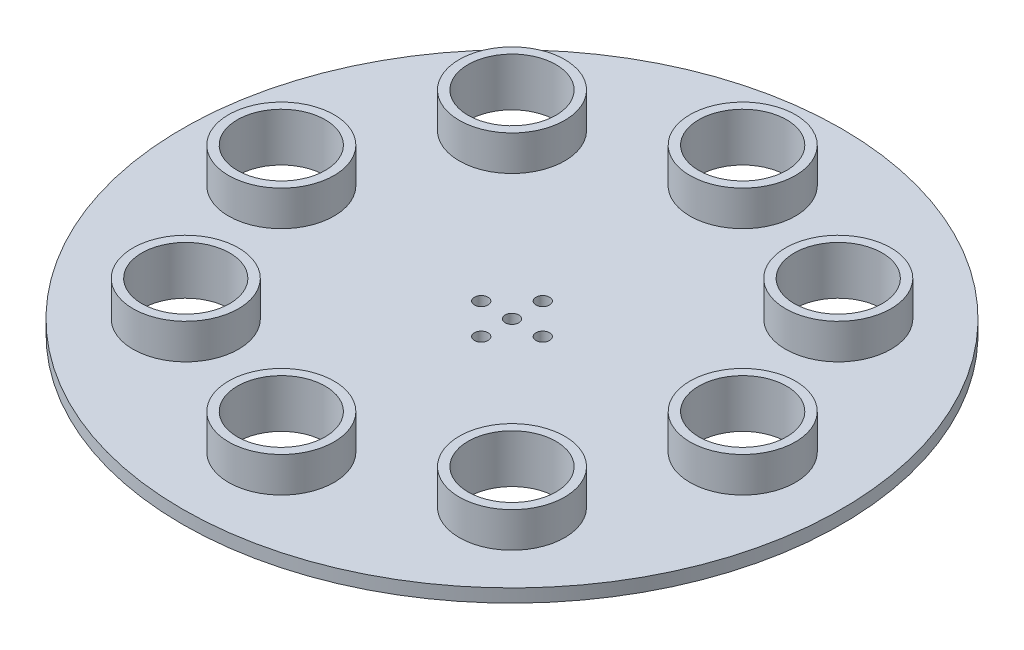
from build123d import *

# Parameters (mm, degrees)
SKETCH_1_R        = 12
SKETCH_1_R_2      = 10
EXTRUDE_2_DEPTH   = 11
EXTRUDE_2_2_DEPTH = 11
EXTRUDE_2_3_DEPTH = 11
EXTRUDE_2_4_DEPTH = 11
EXTRUDE_2_5_DEPTH = 11
EXTRUDE_2_6_DEPTH = 11
EXTRUDE_2_7_DEPTH = 11
EXTRUDE_2_8_DEPTH = 11
SKETCH_1_8_R      = 75
SKETCH_1_8_R_2    = 12
SKETCH_1_8_R_3    = 1.55
EXTRUDE_3_DEPTH   = 3


with BuildPart() as part:
    # 草图1 → 凸台-拉伸2 (new body)
    with BuildSketch(Plane(origin=(0, 0, 0), x_dir=(1, 0, 0), z_dir=(0, 1, 0))):
        with Locations((-37.123106012, 37.123106012)):
            Circle(SKETCH_1_R)
        with Locations((-37.123106012, 37.123106012)):
            Circle(SKETCH_1_R_2, mode=Mode.SUBTRACT)
    extrude(amount=EXTRUDE_2_DEPTH)


with BuildPart() as body_2:
    # 草图1 → Extrude 2 2 (new body)
    with BuildSketch(Plane(origin=(0, 0, 0), x_dir=(1, 0, 0), z_dir=(0, 1, 0))):
        with Locations((0, 52.5)):
            Circle(SKETCH_1_R)
        with Locations((0, 52.5)):
            Circle(SKETCH_1_R_2, mode=Mode.SUBTRACT)
    extrude(amount=EXTRUDE_2_2_DEPTH)


with BuildPart() as body_3:
    # 草图1 → Extrude 2 3 (new body)
    with BuildSketch(Plane(origin=(0, 0, 0), x_dir=(1, 0, 0), z_dir=(0, 1, 0))):
        with Locations((37.123106012, 37.123106012)):
            Circle(SKETCH_1_R)
        with Locations((37.123106012, 37.123106012)):
            Circle(SKETCH_1_R_2, mode=Mode.SUBTRACT)
    extrude(amount=EXTRUDE_2_3_DEPTH)


with BuildPart() as body_4:
    # 草图1 → Extrude 2 4 (new body)
    with BuildSketch(Plane(origin=(0, 0, 0), x_dir=(1, 0, 0), z_dir=(0, 1, 0))):
        with Locations((52.5, 0)):
            Circle(SKETCH_1_R)
        with Locations((52.5, 0)):
            Circle(SKETCH_1_R_2, mode=Mode.SUBTRACT)
    extrude(amount=EXTRUDE_2_4_DEPTH)


with BuildPart() as body_5:
    # 草图1 → Extrude 2 5 (new body)
    with BuildSketch(Plane(origin=(0, 0, 0), x_dir=(1, 0, 0), z_dir=(0, 1, 0))):
        with Locations((37.123106012, -37.123106012)):
            Circle(SKETCH_1_R)
        with Locations((37.123106012, -37.123106012)):
            Circle(SKETCH_1_R_2, mode=Mode.SUBTRACT)
    extrude(amount=EXTRUDE_2_5_DEPTH)


with BuildPart() as body_6:
    # 草图1 → Extrude 2 6 (new body)
    with BuildSketch(Plane(origin=(0, 0, 0), x_dir=(1, 0, 0), z_dir=(0, 1, 0))):
        with Locations((0, -52.5)):
            Circle(SKETCH_1_R)
        with Locations((0, -52.5)):
            Circle(SKETCH_1_R_2, mode=Mode.SUBTRACT)
    extrude(amount=EXTRUDE_2_6_DEPTH)


with BuildPart() as body_7:
    # 草图1 → Extrude 2 7 (new body)
    with BuildSketch(Plane(origin=(0, 0, 0), x_dir=(1, 0, 0), z_dir=(0, 1, 0))):
        with Locations((-37.123106012, -37.123106012)):
            Circle(SKETCH_1_R)
        with Locations((-37.123106012, -37.123106012)):
            Circle(SKETCH_1_R_2, mode=Mode.SUBTRACT)
    extrude(amount=EXTRUDE_2_7_DEPTH)


with BuildPart() as body_8:
    # 草图1 → Extrude 2 8 (new body)
    with BuildSketch(Plane(origin=(0, 0, 0), x_dir=(1, 0, 0), z_dir=(0, 1, 0))):
        with Locations((-52.5, 0)):
            Circle(SKETCH_1_R)
        with Locations((-52.5, 0)):
            Circle(SKETCH_1_R_2, mode=Mode.SUBTRACT)
    extrude(amount=EXTRUDE_2_8_DEPTH)


with BuildPart() as body_9:
    # 草图1<8> → 凸台-拉伸3 (new body)
    with BuildSketch(Plane(origin=(0, 0, 0), x_dir=(1, 0, 0), z_dir=(0, 1, 0))):
        Circle(SKETCH_1_8_R)
        with Locations((-37.123106012, -37.123106012)):
            Circle(SKETCH_1_8_R_2, mode=Mode.SUBTRACT)
        with Locations((0, -52.5)):
            Circle(SKETCH_1_8_R_2, mode=Mode.SUBTRACT)
        with Locations((37.123106012, -37.123106012)):
            Circle(SKETCH_1_8_R_2, mode=Mode.SUBTRACT)
        with Locations((0, -7)):
            Circle(SKETCH_1_8_R_3, mode=Mode.SUBTRACT)
        with Locations((-52.5, 0)):
            Circle(SKETCH_1_8_R_2, mode=Mode.SUBTRACT)
        with Locations((-7, 0)):
            Circle(SKETCH_1_8_R_3, mode=Mode.SUBTRACT)
        with Locations((-37.123106012, 37.123106012)):
            Circle(SKETCH_1_8_R_2, mode=Mode.SUBTRACT)
        Circle(SKETCH_1_8_R_3, mode=Mode.SUBTRACT)
        with Locations((7, 0)):
            Circle(SKETCH_1_8_R_3, mode=Mode.SUBTRACT)
        with Locations((0, 7)):
            Circle(SKETCH_1_8_R_3, mode=Mode.SUBTRACT)
        with Locations((37.123106012, 37.123106012)):
            Circle(SKETCH_1_8_R_2, mode=Mode.SUBTRACT)
        with Locations((52.5, 0)):
            Circle(SKETCH_1_8_R_2, mode=Mode.SUBTRACT)
        with Locations((0, 52.5)):
            Circle(SKETCH_1_8_R_2, mode=Mode.SUBTRACT)
    extrude(amount=EXTRUDE_3_DEPTH)


solid = Compound([part.part, body_2.part, body_3.part, body_4.part, body_5.part, body_6.part, body_7.part, body_8.part, body_9.part])
